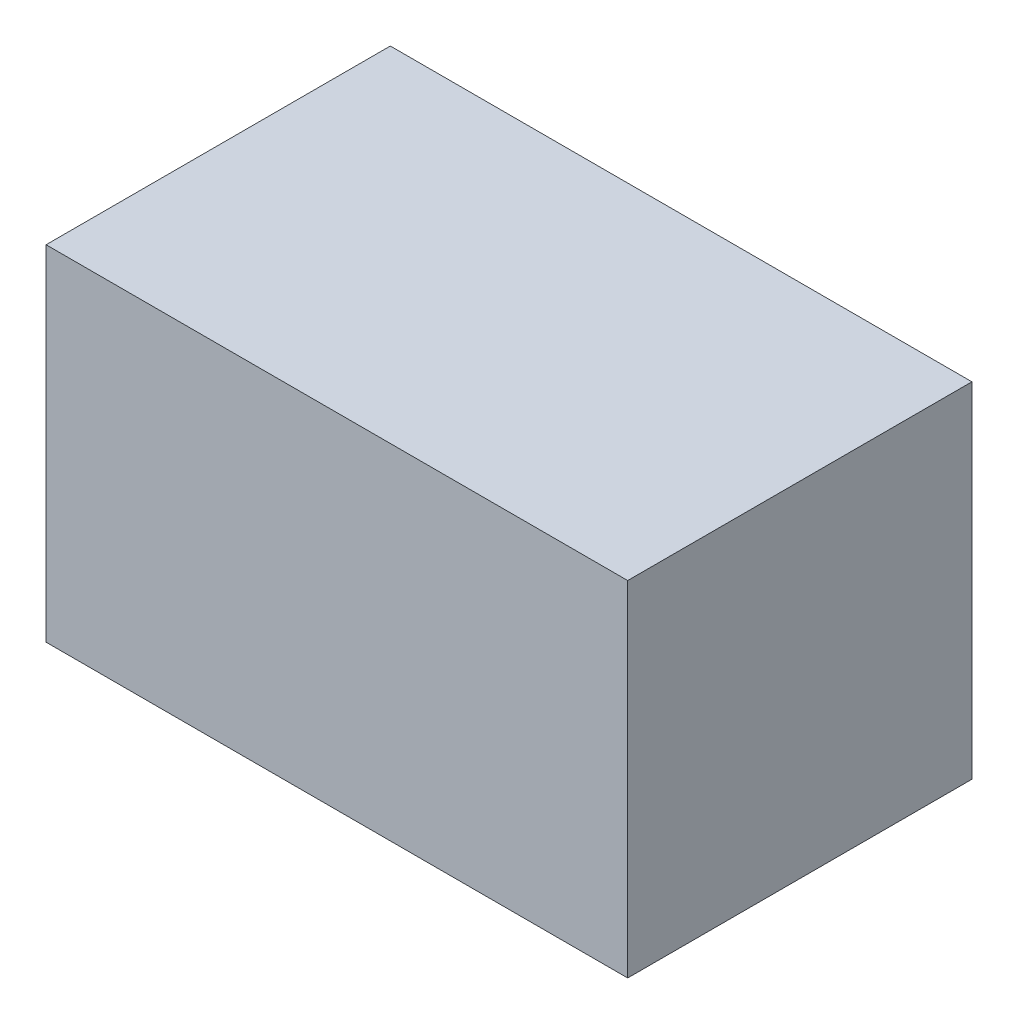
from build123d import *

# Parameters (mm, degrees)
ESQUISSE1_W        = 490
ESQUISSE1_H        = 290
BOSS_EXTRU_1_DEPTH = 290


with BuildPart() as part:
    # Esquisse1 → Boss.-Extru.1 (new body)
    with BuildSketch(Plane.XY):
        Rectangle(ESQUISSE1_W, ESQUISSE1_H)
    extrude(amount=BOSS_EXTRU_1_DEPTH)


solid = part.part
